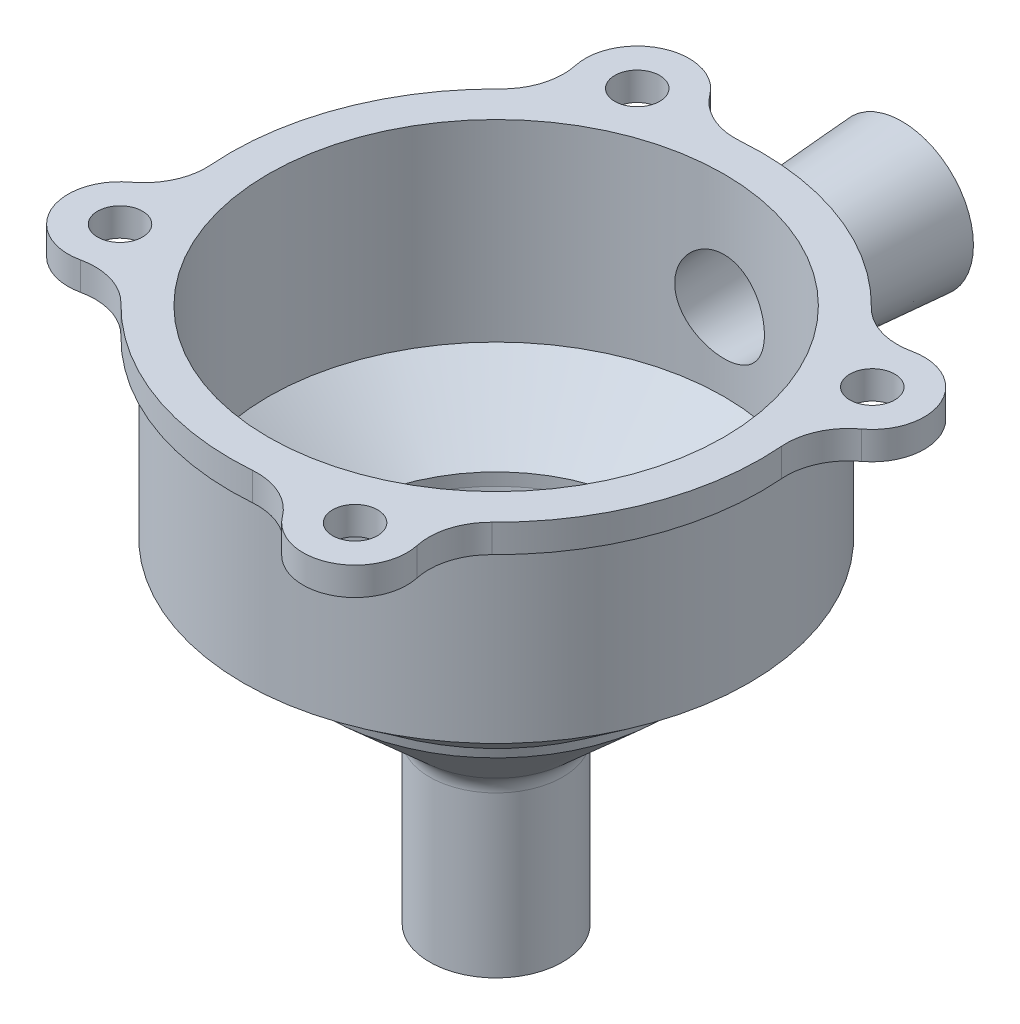
from build123d import *

# Parameters (mm, degrees)
SKETCH2_R                = 40
SKETCH2_R_2              = 1.8
CUT_EXTRUDE1_DEPTH       = 23
BOSS_EXTRUDE1_REACH      = 119.113
BOSS_EXTRUDE1_END_RADIUS = 20.25
BOSS_EXTRUDE1_START      = -40
SKETCH3_R                = 6.25
BOSS_EXTRUDE1_DRAFT      = 4
FILLET4_R                = 2
FILLET5_R                = 5
SKETCH6_R                = 4.75
CUT_EXTRUDE3_DEPTH       = 30
CUT_EXTRUDE3_DRAFT       = -3
SKETCH7_W                = 15
SKETCH7_H                = 15
CUT_EXTRUDE4_DEPTH       = 30
FILLET6_R                = 0.75


with BuildPart() as part:
    # Sketch1 → Revolve1 (revolve)
    with BuildSketch(Plane.XY, mode=Mode.PRIVATE) as revolve1_sk:
        Polygon((-55.622837474, -3.756740331), (-55.48675224, -4.506740331), (-47.639036934, -11.536740331), (-47.639036934, -25.528383449), (-48.839036934, -25.528383449), (-48.839036934, -11.804335585), (-56.98547363, -4.506740331), (-57.121558863, -3.756740331), (-63.760738018, 1.288772825), (-63.760738018, 15.093259669), (-75.524316467, 15.093259669), (-75.524316467, 17.343259669), (-61.760738018, 17.343259669), (-61.760738018, 15.093259669), (-61.760738018, 1.907820938), (-55.622837474, -2.756740331), align=None)
    revolve(revolve1_sk.sketch.rotate(Axis((-43.510738018, -15.472511469, 0), (0, 1, 0)), 270), axis=Axis((-43.510738018, -15.472511469, 0), (0, 1, 0)))

    # Sketch2 → Cut-Extrude1 (cut)
    # profile 1 of 5: a face of its own
    with BuildSketch(Plane(origin=(0, 17.343259669, 0), x_dir=(1, 0, 0), z_dir=(0, 1, 0))):
        with Locations((-43.510738018, 0)):
            Circle(SKETCH2_R)
        with BuildLine():
            ThreePointArc((-22.920677049, 5.254701636), (-19.012213599, 11.134068048), (-26.011720482, 12.0559896))
            ThreePointArc((-26.011720482, 12.0559896), (-36.048271167, 19.896584845), (-48.765439654, 20.590060969))
            ThreePointArc((-48.765439654, 20.590060969), (-54.644806066, 24.498524419), (-55.566727619, 17.499017537))
            ThreePointArc((-55.566727619, 17.499017537), (-63.407322863, 7.462466851), (-64.100798988, -5.254701636))
            ThreePointArc((-64.100798988, -5.254701636), (-68.009262438, -11.134068048), (-61.009755555, -12.0559896))
            ThreePointArc((-61.009755555, -12.0559896), (-50.973204869, -19.896584845), (-38.256036382, -20.590060969))
            ThreePointArc((-38.256036382, -20.590060969), (-32.37666997, -24.498524419), (-31.454748418, -17.499017537))
            ThreePointArc((-31.454748418, -17.499017537), (-23.614153173, -7.462466851), (-22.920677049, 5.254701636))
        make_face(mode=Mode.SUBTRACT)
    # profile 2 of 5: a face of its own
    with BuildSketch(Plane(origin=(0, 17.343259669, 0), x_dir=(1, 0, 0), z_dir=(0, 1, 0))):
        with Locations(Location((-52.923616522, 20.711354815, 0), (0, 0, 270))):
            Circle(SKETCH2_R_2)
    # profile 3 of 5: a face of its own
    with BuildSketch(Plane(origin=(0, 17.343259669, 0), x_dir=(1, 0, 0), z_dir=(0, 1, 0))):
        with Locations(Location((-64.222092833, -9.412878504, 0), (0, 0, 270))):
            Circle(SKETCH2_R_2)
    # profile 4 of 5: a face of its own
    with BuildSketch(Plane(origin=(0, 17.343259669, 0), x_dir=(1, 0, 0), z_dir=(0, 1, 0))):
        with Locations(Location((-34.097859515, -20.711354815, 0), (0, 0, 270))):
            Circle(SKETCH2_R_2)
    # profile 5 of 5: a face of its own
    with BuildSketch(Plane(origin=(0, 17.343259669, 0), x_dir=(1, 0, 0), z_dir=(0, 1, 0))):
        with Locations(Location((-22.799383203, 9.412878504, 0), (0, 0, 270))):
            Circle(SKETCH2_R_2)
    extrude(amount=-CUT_EXTRUDE1_DEPTH, mode=Mode.SUBTRACT)

    # Boss-Extrude1: up to this cylinder (the profile starts outside it)
    boss_extrude1_end = Plane(origin=(-43.510738018, 8.15, 0), z_dir=(0, -1, 0)) * Cylinder(BOSS_EXTRUDE1_END_RADIUS, 279.726, mode=Mode.PRIVATE)



with BuildPart() as boss_extrude1_long_prism_1:
    # Sketch3 → Boss-Extrude1 (the long prism of profile 1, to be tilted and cut off)
    with BuildSketch(Plane.XY.offset(BOSS_EXTRUDE1_START)):
        with Locations((-43.510738018, 8.15)):
            Circle(SKETCH3_R)
    extrude(amount=BOSS_EXTRUDE1_REACH)
    boss_extrude1_tool1_sides = [boss_extrude1_long_prism_1.faces().sort_by_distance(p)[0] for p in [
        (-49.760738018, 8.15, 19.5565),
    ]]
    draft(boss_extrude1_tool1_sides, Plane.XY.offset(BOSS_EXTRUDE1_START), BOSS_EXTRUDE1_DRAFT)  # the draft: side faces tilted about the start plane


with BuildPart() as part_1:
    add(part.part)
    boss_extrude1_tool1 = boss_extrude1_long_prism_1.part - boss_extrude1_end
    add(boss_extrude1_tool1.solids().sort_by_distance((-43.510738, 8.15, -40))[0])

    # Fillet4
    fillet4_edges = [part_1.edges().sort_by_distance(p)[0] for p in [
        (-43.510738018, -11.804335585, 5.328298916),
    ]]
    fillet(fillet4_edges, radius=FILLET4_R)

    # Fillet5
    fillet5_edges = [part_1.edges().sort_by_distance(p)[0] for p in [
        (-61.009755555, 16.218259669, 12.0559896),
        (-38.256036382, 16.218259669, 20.590060969),
        (-31.454748418, 16.218259669, 17.499017537),
        (-22.920677049, 16.218259669, -5.254701636),
        (-26.011720482, 16.218259669, -12.0559896),
        (-48.765439654, 16.218259669, -20.590060969),
        (-55.566727619, 16.218259669, -17.499017537),
        (-64.100798988, 16.218259669, 5.254701636),
    ]]
    fillet(fillet5_edges, radius=FILLET5_R)


with BuildPart() as cut_extrude3_tool:
    # Sketch6 → Cut-Extrude3 (with draft: the straight prism first)
    with BuildSketch(Plane(origin=(0, 0, -40), x_dir=(-1, 0, 0), z_dir=(0, 0, -1))):
        with Locations((43.510738018, 8.15)):
            Circle(SKETCH6_R)
    extrude(amount=-CUT_EXTRUDE3_DEPTH)
    # Cut-Extrude3: the draft: its side faces are tilted about the plane it starts from
    cut_extrude3_sides = [cut_extrude3_tool.faces().sort_by_distance(p)[0] for p in [
        (-38.760738018, 8.15, -25),
    ]]
    draft(cut_extrude3_sides, Plane(origin=(0, 0, -40), x_dir=(-1, 0, 0), z_dir=(0, 0, -1)), CUT_EXTRUDE3_DRAFT)


with BuildPart() as part_2:
    add(part_1.part)

    # Cut-Extrude3: cut by cut_extrude3_tool
    add(cut_extrude3_tool.part, mode=Mode.SUBTRACT)

    # Sketch7 → Cut-Extrude4 (cut)
    with BuildSketch(Plane(origin=(0, 17.343259669, 0), x_dir=(1, 0, 0), z_dir=(0, 1, 0))):
        with Locations((-43.510738018, 40)):
            Rectangle(SKETCH7_W, SKETCH7_H)
    extrude(amount=-CUT_EXTRUDE4_DEPTH, mode=Mode.SUBTRACT)

    # Fillet6
    fillet6_edges = [part_2.edges().sort_by_distance(p)[0] for p in [
        (-40.089443967, 11.585631276, -19.958888922),
    ]]
    fillet(fillet6_edges, radius=FILLET6_R)


solid = part_2.part
